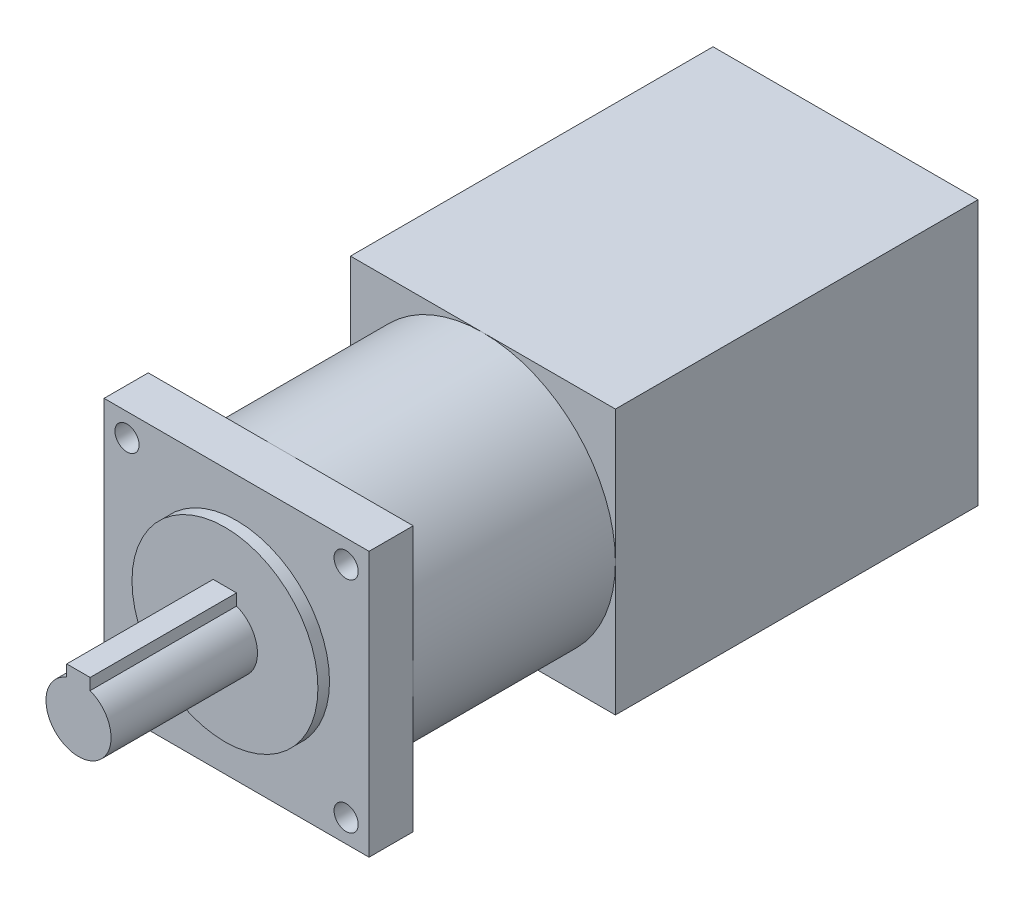
from build123d import *

# Parameters (mm, degrees)
SKETCH_1_W          = 57
SKETCH_1_H          = 57
EXTRUDE_1_DEPTH     = 78
SKETCH_2_R          = 28.5
EXTRUDE_2_DEPTH     = 53
SKETCH_3_R          = 20
EXTRUDE_3_DEPTH     = 2.5
EXTRUDE_4_DEPTH     = 31.5
SKETCH_5_R          = 2
CUT_EXTRUDE_1_DEPTH = 4
SKETCH_6_W          = 57
SKETCH_6_H          = 57
SKETCH_6_R          = 2.6
EXTRUDE_5_DEPTH     = 9.5


with BuildPart() as part:
    # 草图1 → 凸台-拉伸1 (new body)
    with BuildSketch(Plane.XY):
        Rectangle(SKETCH_1_W, SKETCH_1_H)
    extrude(amount=EXTRUDE_1_DEPTH)

    # 草图2 → 凸台-拉伸2 (add)
    with BuildSketch(Plane.XY.offset(78)):
        Circle(SKETCH_2_R)
    extrude(amount=EXTRUDE_2_DEPTH)

    # 草图3 → 凸台-拉伸3 (add)
    with BuildSketch(Plane.XY.offset(131)):
        Circle(SKETCH_3_R)
    extrude(amount=EXTRUDE_3_DEPTH)

    # 草图4 → 凸台-拉伸4 (add)
    with BuildSketch(Plane.XY.offset(133.5)):
        with BuildLine():
            Line((0, 9), (2.5, 9))
            Line((2.5, 9), (2.5, 6.538348415))
            ThreePointArc((2.5, 6.538348415), (0.021437338, -6.999967174), (-2.54, 6.522913459))
            Line((-2.54, 6.522913459), (-2.54, 9))
            Line((-2.54, 9), (0, 9))
        make_face()
    extrude(amount=EXTRUDE_4_DEPTH)

    # 草图5 → 切除-拉伸1 (cut)
    with BuildSketch(Plane.XY.offset(131)):
        with Locations((0, -17.5)):
            Circle(SKETCH_5_R)
        with Locations((-17.5, 0)):
            Circle(SKETCH_5_R)
        with Locations((0, 17.5)):
            Circle(SKETCH_5_R)
        with Locations((17.5, 0)):
            Circle(SKETCH_5_R)
    extrude(amount=-CUT_EXTRUDE_1_DEPTH, mode=Mode.SUBTRACT)

    # 草图6 → 凸台-拉伸5 (add)
    with BuildSketch(Plane.XY.offset(131)):
        Rectangle(SKETCH_6_W, SKETCH_6_H)
        with Locations((-23.57, 23.57)):
            Circle(SKETCH_6_R, mode=Mode.SUBTRACT)
        with Locations((23.57, 23.57)):
            Circle(SKETCH_6_R, mode=Mode.SUBTRACT)
        with Locations((23.57, -23.57)):
            Circle(SKETCH_6_R, mode=Mode.SUBTRACT)
        with Locations((-23.57, -23.57)):
            Circle(SKETCH_6_R, mode=Mode.SUBTRACT)
    extrude(amount=-EXTRUDE_5_DEPTH)


solid = part.part
